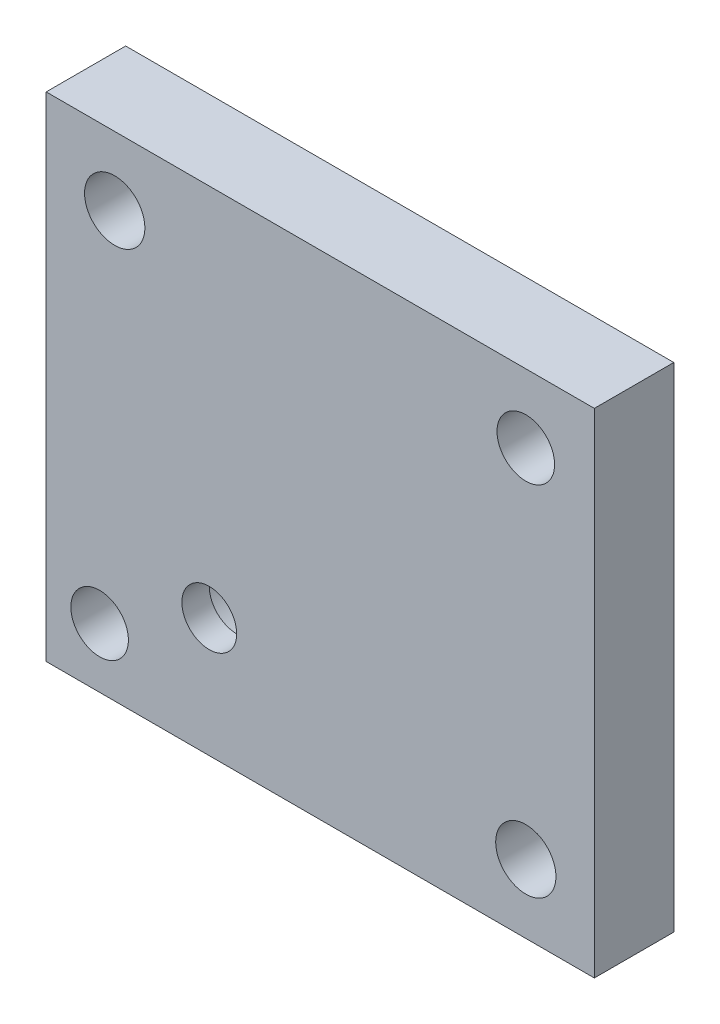
from build123d import *

# Parameters (mm, degrees)
SKETCH1_R           = 1.1
SKETCH1_R_2         = 1.05
SKETCH1_R_3         = 2
BOSS_EXTRUDE1_DEPTH = 1.9
SKETCH2_W           = 20
SKETCH2_H           = 18
SKETCH2_R           = 1.1
SKETCH2_R_2         = 1.05
SKETCH2_R_3         = 1
BOSS_EXTRUDE2_DEPTH = 1


with BuildPart() as part:
    # Sketch1 → Boss-Extrude1 (new body)
    with BuildSketch(Plane.XY):
        Polygon((-10, 9), (10, 9), (10, -9), (-10, -9), (-10, -1.1), (-10, 4), align=None)
        with Locations(Location((7.5, -6.5, 0), (0, 0, 180))):
            Circle(SKETCH1_R, mode=Mode.SUBTRACT)
        with Locations(Location((-7.5, 6.5, 0), (0, 0, 180))):
            Circle(SKETCH1_R, mode=Mode.SUBTRACT)
        with Locations(Location((-8.05, -6.825, 0), (0, 0, 180))):
            Circle(SKETCH1_R_2, mode=Mode.SUBTRACT)
        with Locations(Location((7.5, 6.5, 0), (0, 0, 180))):
            Circle(SKETCH1_R_2, mode=Mode.SUBTRACT)
        with Locations(Location((-4.05, -4.65, 0), (0, 0, 180))):
            Circle(SKETCH1_R_3, mode=Mode.SUBTRACT)
    extrude(amount=BOSS_EXTRUDE1_DEPTH)

    # Sketch2 → Boss-Extrude2 (add)
    with BuildSketch(Plane.XY.offset(1.9)):
        Rectangle(SKETCH2_W, SKETCH2_H)
        with Locations(Location((-7.5, 6.5, 0), (0, 0, 180))):
            Circle(SKETCH2_R, mode=Mode.SUBTRACT)
        with Locations(Location((7.5, 6.5, 0), (0, 0, 180))):
            Circle(SKETCH2_R_2, mode=Mode.SUBTRACT)
        with Locations(Location((7.5, -6.5, 0), (0, 0, 180))):
            Circle(SKETCH2_R, mode=Mode.SUBTRACT)
        with Locations(Location((-8.05, -6.825, 0), (0, 0, 180))):
            Circle(SKETCH2_R_2, mode=Mode.SUBTRACT)
        with Locations((-4.05, -4.65)):
            Circle(SKETCH2_R_3, mode=Mode.SUBTRACT)
    extrude(amount=BOSS_EXTRUDE2_DEPTH)


solid = part.part
